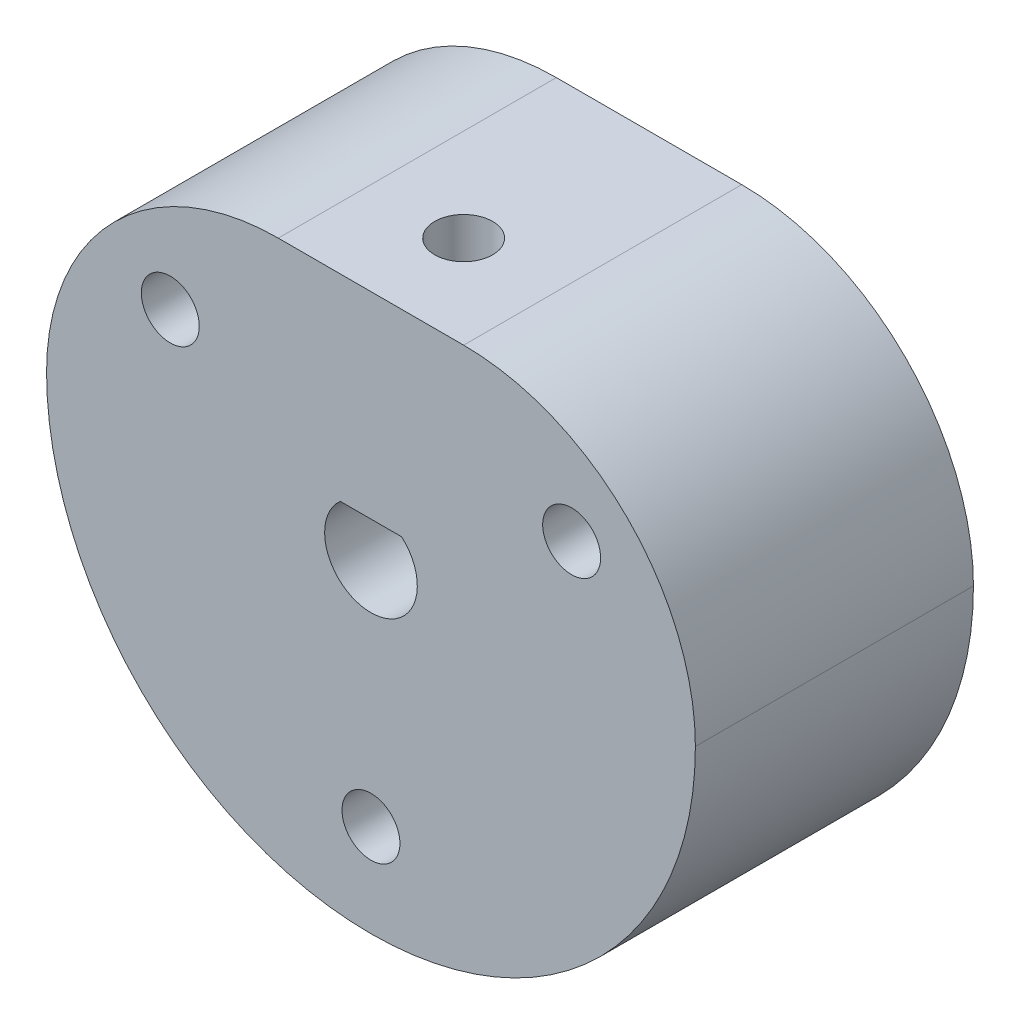
from build123d import *

# Parameters (mm, degrees)
SKETCH_1_R          = 1.25
EXTRUDE_1_DEPTH     = 12
SKETCH_3_R          = 1.25
CUT_EXTRUDE_1_DEPTH = 8.5
FILLET_1_R          = 10


with BuildPart() as part:
    # ｽｹｯﾁ1 → ﾎﾞｽ - 押し出し1 (new body)
    with BuildSketch(Plane.XY):
        with BuildLine():
            Line((-9.797958971, 10), (9.797958971, 10))
            ThreePointArc((9.797958971, 10), (0, -14), (-9.797958971, 10))
        make_face()
        with Locations((-8.660254038, 5)):
            Circle(SKETCH_1_R, mode=Mode.SUBTRACT)
        with Locations((8.660254038, 5)):
            Circle(SKETCH_1_R, mode=Mode.SUBTRACT)
        with Locations((0, -10)):
            Circle(SKETCH_1_R, mode=Mode.SUBTRACT)
        with BuildLine():
            Line((-1.322875656, 1.5), (1.322875656, 1.5))
            ThreePointArc((1.322875656, 1.5), (0, -2), (-1.322875656, 1.5))
        make_face(mode=Mode.SUBTRACT)
    extrude(amount=EXTRUDE_1_DEPTH)

    # ｽｹｯﾁ3 → ｶｯﾄ - 押し出し1 (cut)
    with BuildSketch(Plane(origin=(0, 10, 0), x_dir=(1, 0, 0), z_dir=(0, 1, 0))):
        with Locations(Location((0, -8, 0), (0, 0, 270))):
            Circle(SKETCH_3_R)
    extrude(amount=-CUT_EXTRUDE_1_DEPTH, mode=Mode.SUBTRACT)

    # ﾌｨﾚｯﾄ1
    fillet_1_edges = [part.edges().sort_by_distance(p)[0] for p in [
        (-9.797958971, 10, 6),
        (9.797958971, 10, 6),
    ]]
    fillet(fillet_1_edges, radius=FILLET_1_R)


solid = part.part
